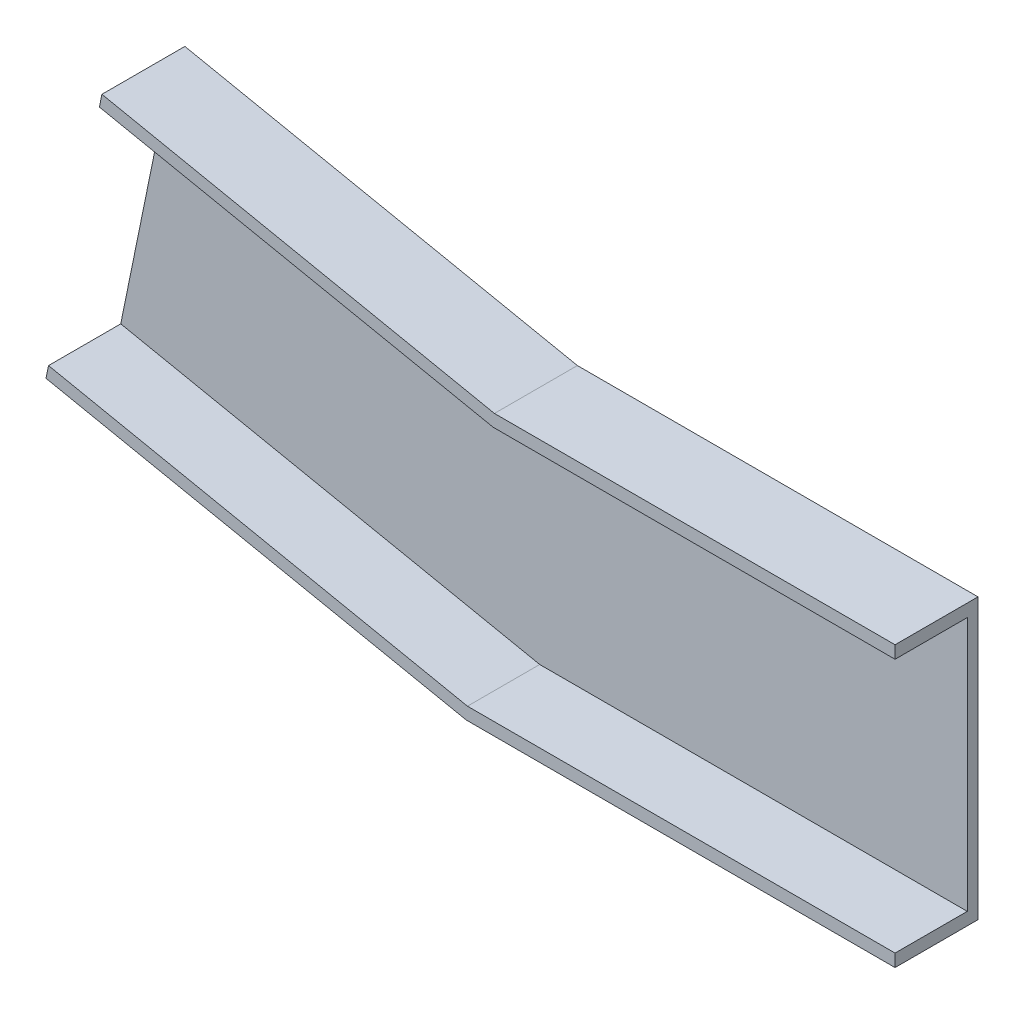
from build123d import *

# Parameters (mm, degrees)
EXTRUDE_1_DEPTH     = 89
CUT_EXTRUDE_1_DEPTH = 77.5


with BuildPart() as part:
    # 草图2 → 凸台-拉伸1 (new body)
    with BuildSketch(Plane.XY):
        Polygon((15.153077165, 150), (445, 150), (445, -150), (-15.153077165, -150), (-466.009174215, -57.969384567), (-406.009174215, 235.969384567), align=None)
    extrude(amount=EXTRUDE_1_DEPTH)

    # 草图3 → 切除-拉伸1 (cut)
    with BuildSketch(Plane.XY.offset(89)):
        Polygon((-408.709174215, 222.742139956), (13.78930022, 136.5), (445, 136.5), (445, -136.5), (-13.78930022, -136.5), (-463.309174215, -44.742139956), align=None)
    extrude(amount=-CUT_EXTRUDE_1_DEPTH, mode=Mode.SUBTRACT)


solid = part.part
